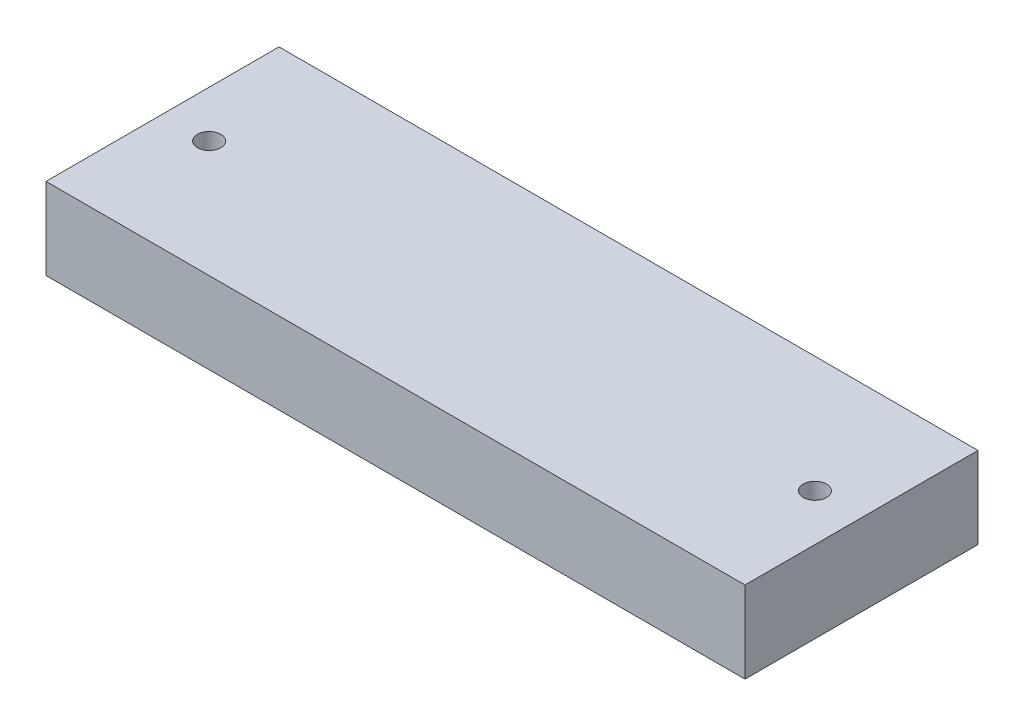
from build123d import *

# Parameters (mm, degrees)
SKETCH1_W           = 300
SKETCH1_H           = 100
BOSS_EXTRUDE1_DEPTH = 35
SKETCH2_R           = 5
CUT_EXTRUDE1_DEPTH  = 162.941347407


with BuildPart() as part:
    # Sketch1 → Boss-Extrude1 (new body)
    with BuildSketch(Plane(origin=(0, 0, 0), x_dir=(1, 0, 0), z_dir=(0, 1, 0))):
        Rectangle(SKETCH1_W, SKETCH1_H)
    extrude(amount=BOSS_EXTRUDE1_DEPTH)

    # Sketch2 → Cut-Extrude1 (cut, through all)
    with BuildSketch(Plane(origin=(0, 35, 0), x_dir=(1, 0, 0), z_dir=(0, 1, 0))):
        with Locations(Location((-130, 0, 0), (0, 0, 270))):
            Circle(SKETCH2_R)
        with Locations(Location((130, 0, 0), (0, 0, 90))):
            Circle(SKETCH2_R)
    extrude(amount=-CUT_EXTRUDE1_DEPTH, mode=Mode.SUBTRACT)


solid = part.part
